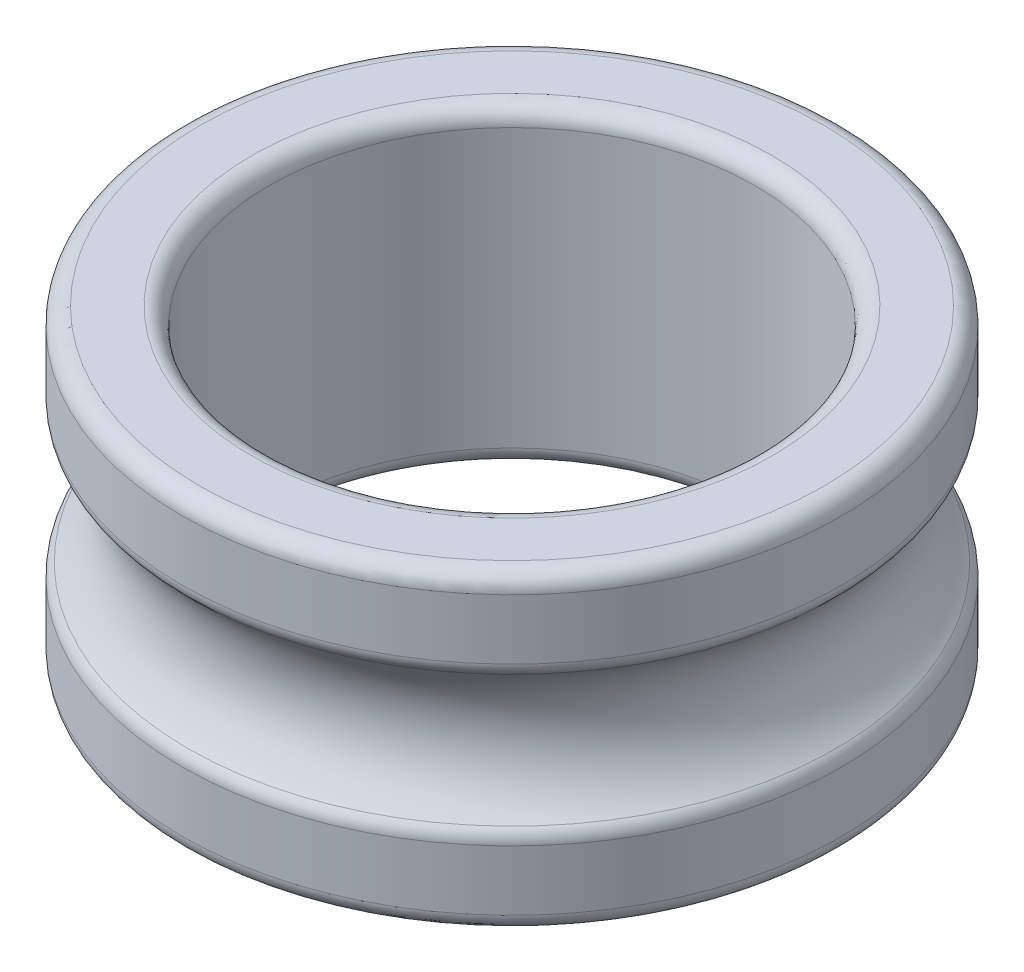
from build123d import *


with BuildPart() as part:
    # Sketch1 → Revolve1 (revolve)
    with BuildSketch(Plane(origin=(0, 0, 0), x_dir=(0, 0, -1), z_dir=(1, 0, 0))):
        with BuildLine():
            Line((14, 8), (14, -8))
            ThreePointArc((14, -8), (14.292893219, -8.707106781), (15, -9))
            Line((15, -9), (18, -9))
            ThreePointArc((18, -9), (18.707106781, -8.707106781), (19, -8))
            Line((19, -8), (19, -4.538997687))
            ThreePointArc((19, -4.538997687), (18.911360803, -4.127389271), (18.661157025, -3.788750135))
            ThreePointArc((18.661157025, -3.788750135), (16.95, 0), (18.661157025, 3.788750135))
            ThreePointArc((18.661157025, 3.788750135), (18.911360803, 4.127389271), (19, 4.538997687))
            Line((19, 4.538997687), (19, 8))
            ThreePointArc((19, 8), (18.707106781, 8.707106781), (18, 9))
            Line((18, 9), (15, 9))
            ThreePointArc((15, 9), (14.292893219, 8.707106781), (14, 8))
        make_face()
    revolve(axis=Axis((0, -9.810774163, 0), (0, 1, 0)))


solid = part.part
